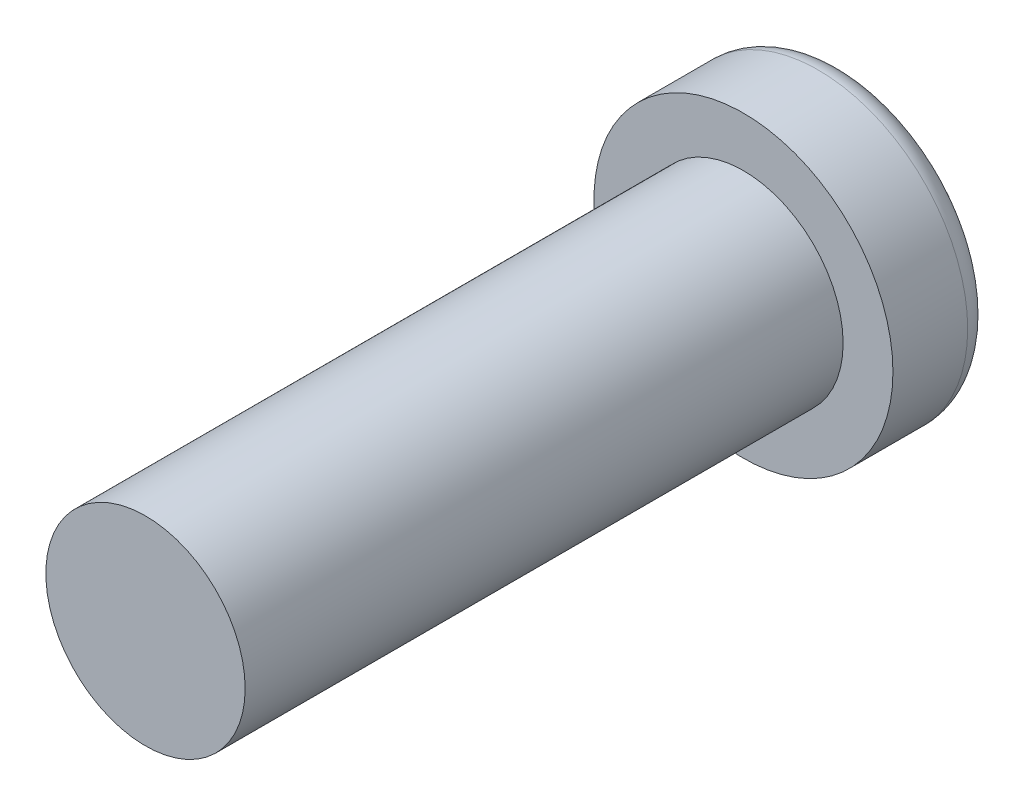
from build123d import *

# Parameters (mm, degrees)
SKETCH1_R           = 3
BOSS_EXTRUDE1_DEPTH = 2
SKETCH2_R           = 2
BOSS_EXTRUDE2_DEPTH = 12
FILLET2_R           = 0.5


with BuildPart() as part:
    # Sketch1 → Boss-Extrude1 (new body)
    with BuildSketch(Plane.XY):
        Circle(SKETCH1_R)
    extrude(amount=BOSS_EXTRUDE1_DEPTH)

    # Sketch2 → Boss-Extrude2 (add)
    with BuildSketch(Plane.XY.offset(2)):
        Circle(SKETCH2_R)
    extrude(amount=BOSS_EXTRUDE2_DEPTH)

    # Fillet2
    fillet2_edges = [part.edges().sort_by_distance(p)[0] for p in [
        (-3, 0, 0),
    ]]
    fillet(fillet2_edges, radius=FILLET2_R)


solid = part.part
